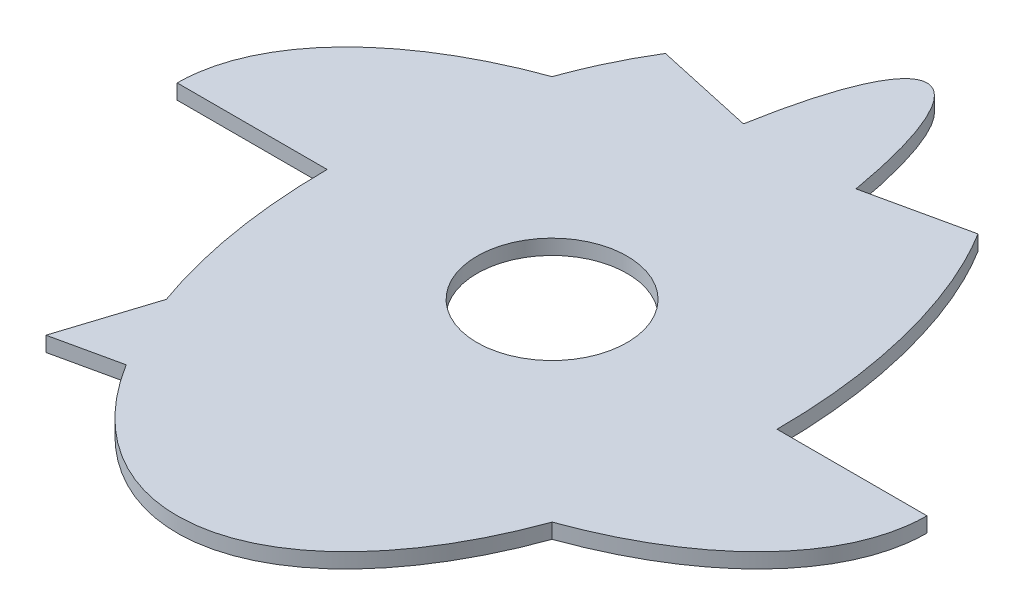
from build123d import *

# Parameters (mm, degrees)
SZKIC1_R                    = 10
DODANIE_WYCI_GNI_CIE1_DEPTH = 2


with BuildPart() as part:
    # Szkic1 → Dodanie-wyciągnięcie1 (new body)
    with BuildSketch(Plane(origin=(0, 0, 0), x_dir=(1, 0, 0), z_dir=(0, 1, 0))):
        with BuildLine():
            add(Edge.make_bspline(
                [(20.843852414, -35.960387795), (23.68927397, -31.378992774), (25.724787771, -25.724787771)],
                knots=[0.768134938, 0.768134938, 0.768134938, 1.030376827, 1.030376827, 1.030376827], degree=2, weights=[1, 0.991415958, 1]))
            add(Edge.make_bspline(
                [(25.724787771, -25.724787771), (50, -16.985711369), (50, 0)],
                knots=[5.252808481, 5.252808481, 5.252808481, 6.283185307, 6.283185307, 6.283185307], degree=2, weights=[1, 0.870199907, 1]))
            Line((50, 0), (30, 0))
            add(Edge.make_bspline(
                [(30, 0), (30, 13.849198247), (25.724787771, 25.724787771)],
                knots=[1.570796327, 1.570796327, 1.570796327, 2.111215827, 2.111215827, 2.111215827], degree=2, weights=[1, 0.963714928, 1]))
            add(Edge.make_bspline(
                [(25.724787771, 25.724787771), (23.68927397, 31.378992774), (20.843852414, 35.960387795)],
                knots=[2.111215827, 2.111215827, 2.111215827, 2.373457716, 2.373457716, 2.373457716], degree=2, weights=[1, 0.991415958, 1]))
            Line((20.843852414, 35.960387795), (7.507535684, 33.029118956))
            add(Edge.make_bspline(
                [(7.507535684, 33.029118956), (5.218865934, 46.034514162), (1.811566447, 49.17271271)],
                knots=[5.433983203, 5.433983203, 5.433983203, 6.101022879, 6.101022879, 6.101022879], degree=2, weights=[1, 0.944895907, 1]))
            add(Edge.make_bspline(
                [(1.811566447, 49.17271271), (0.913339162, 50), (0, 50)],
                knots=[6.101022879, 6.101022879, 6.101022879, 6.283185307, 6.283185307, 6.283185307], degree=2, weights=[1, 0.995854973, 1]))
            add(Edge.make_bspline(
                [(0, 50), (-0.913339162, 50), (-1.811566447, 49.17271271)],
                knots=[0, 0, 0, 0.182162428, 0.182162428, 0.182162428], degree=2, weights=[1, 0.995854973, 1]))
            add(Edge.make_bspline(
                [(-1.811566447, 49.17271271), (-5.218865934, 46.034514162), (-7.507535684, 33.029118956)],
                knots=[0.182162428, 0.182162428, 0.182162428, 0.849202104, 0.849202104, 0.849202104], degree=2, weights=[1, 0.944895907, 1]))
            Line((-7.507535684, 33.029118956), (-20.843852414, 35.960387795))
            add(Edge.make_bspline(
                [(-20.843852414, 35.960387795), (-23.68927397, 31.378992774), (-25.724787771, 25.724787771)],
                knots=[3.909727591, 3.909727591, 3.909727591, 4.17196948, 4.17196948, 4.17196948], degree=2, weights=[1, 0.991415958, 1]))
            add(Edge.make_bspline(
                [(-25.724787771, 25.724787771), (-50, 16.985711369), (-50, 0)],
                knots=[2.111215827, 2.111215827, 2.111215827, 3.141592654, 3.141592654, 3.141592654], degree=2, weights=[1, 0.870199907, 1]))
            Line((-50, 0), (-30, 0))
            add(Edge.make_bspline(
                [(-30, 9.5e-08), (-30.000000016, -13.849198204), (-25.724787771, -25.724787771)],
                knots=[4.712388978, 4.712388978, 4.712388978, 5.252808481, 5.252808481, 5.252808481], degree=2, weights=[1, 0.963714928, 1]))
            Line((-25.724787771, -25.724787771), (-29.607826273, -37.88667404))
            Line((-29.607826273, -37.88667404), (-20.843852414, -35.960387795))
            add(Edge.make_bspline(
                [(-20.843852414, -35.960387795), (-12.774167321, -48.953336072), (-1.56928672, -49.931545896)],
                knots=[5.51505037, 5.51505037, 5.51505037, 6.230851865, 6.230851865, 6.230851865], degree=2, weights=[1, 0.936634273, 1]))
            add(Edge.make_bspline(
                [(-1.56928672, -49.931545896), (-0.785180849, -50), (0, -50)],
                knots=[6.230851865, 6.230851865, 6.230851865, 6.283185307, 6.283185307, 6.283185307], degree=2, weights=[1, 0.999657671, 1]))
            add(Edge.make_bspline(
                [(0, -50), (0.785180849, -50), (1.56928672, -49.931545896)],
                knots=[0, 0, 0, 0.052333442, 0.052333442, 0.052333442], degree=2, weights=[1, 0.999657671, 1]))
            add(Edge.make_bspline(
                [(1.56928672, -49.931545896), (12.774167321, -48.953336072), (20.843852414, -35.960387795)],
                knots=[0.052333442, 0.052333442, 0.052333442, 0.768134938, 0.768134938, 0.768134938], degree=2, weights=[1, 0.936634273, 1]))
        make_face()
        with Locations(Location((0, 0, 0), (0, 0, 270))):
            Circle(SZKIC1_R, mode=Mode.SUBTRACT)
    extrude(amount=DODANIE_WYCI_GNI_CIE1_DEPTH)


solid = part.part
